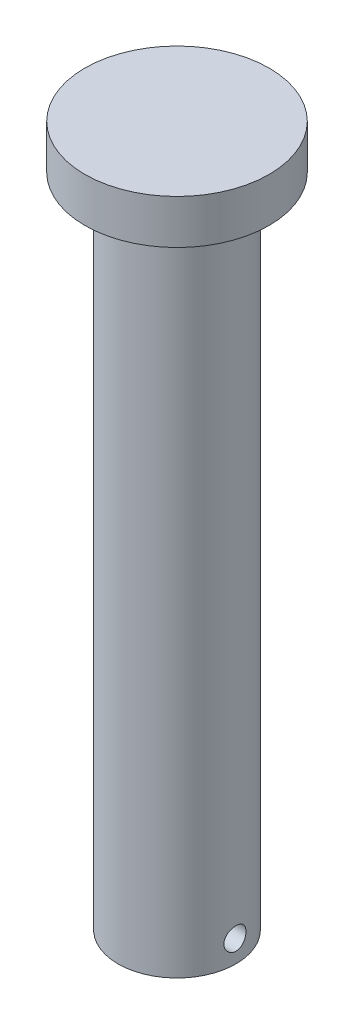
from build123d import *

# Parameters (mm, degrees)
SKETCH4_R               = 16
BOSS_EXTRUDE9_DEPTH     = 178
SKETCH8_R               = 25
BOSS_EXTRUDE10_DEPTH    = 12
CUT_EXTRUDE1_DEPTH      = 194.261480901
CUT_EXTRUDE1_DEPTH_BACK = 194.261480901
SKETCH9_R               = 3


with BuildPart() as part:
    # Sketch4 → Boss-Extrude9 (new body)
    with BuildSketch(Plane(origin=(0, 0, 0), x_dir=(1, 0, 0), z_dir=(0, 1, 0))):
        with Locations(Location((0, 0, 0), (0, 0, 270))):
            Circle(SKETCH4_R)
    extrude(amount=BOSS_EXTRUDE9_DEPTH)

    # Sketch8 → Boss-Extrude10 (add)
    with BuildSketch(Plane(origin=(0, 178, 0), x_dir=(1, 0, 0), z_dir=(0, 1, 0))):
        with Locations(Location((0, 0, 0), (0, 0, 270))):
            Circle(SKETCH8_R)
    extrude(amount=BOSS_EXTRUDE10_DEPTH)

    # Sketch9 → Cut-Extrude1 (cut, two sides: drawn at the far end of the back side and taken through both)
    with BuildSketch(Plane(origin=(0, 0, 0), x_dir=(0, 0, -1), z_dir=(1, 0, 0)).offset(-CUT_EXTRUDE1_DEPTH_BACK)):
        with Locations(Location((0, 6, 0), (0, 0, 180))):
            Circle(SKETCH9_R)
    extrude(amount=CUT_EXTRUDE1_DEPTH + CUT_EXTRUDE1_DEPTH_BACK, mode=Mode.SUBTRACT)


solid = part.part
